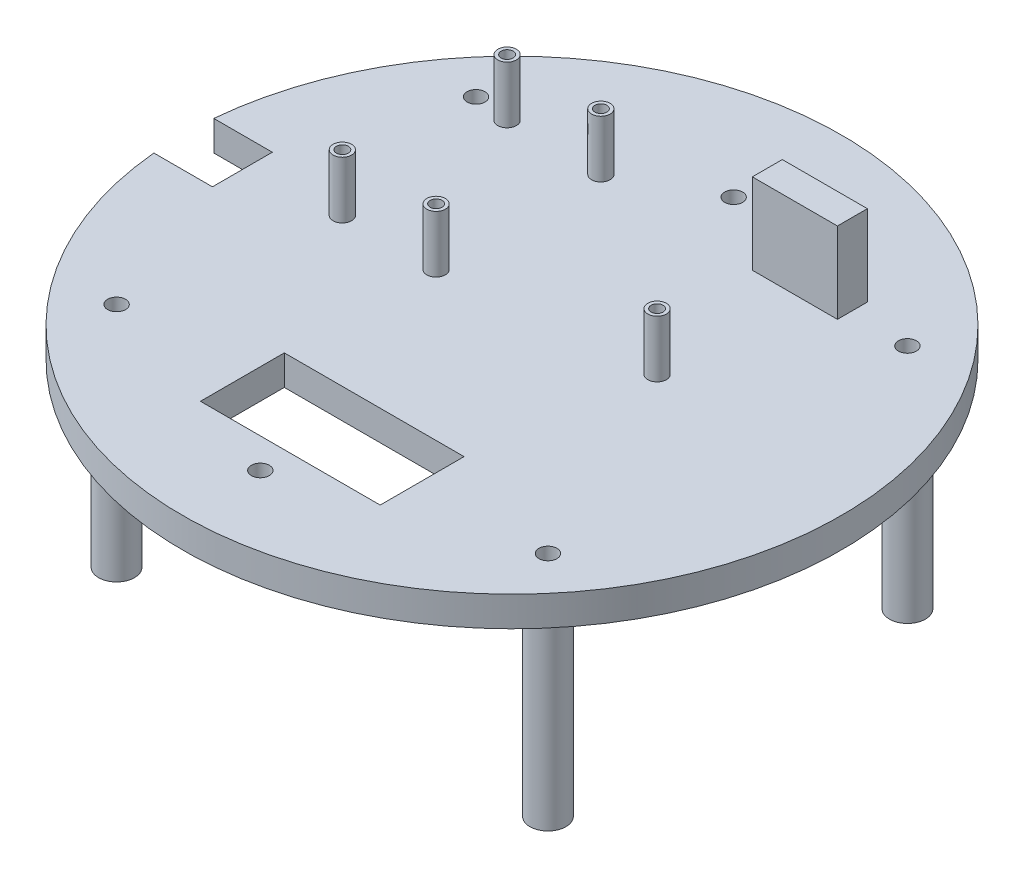
from build123d import *

# Parameters (mm, degrees)
SKETCH2_R                 = 55
SKETCH2_W                 = 30
SKETCH2_H                 = 14
BOSS_EXTRUDE1_DEPTH       = 5
SKETCH3_R                 = 2.5
BOSS_EXTRUDE2_DEPTH       = 6
F_2_5MM_DOWEL_HOLE2_D     = 2.5
F_2_5MM_DOWEL_HOLE2_DEPTH = 10.15
F_2_5MM_DOWEL_HOLE2_TIP   = 0.751075774
SKETCH15_R                = 1.55
BOSS_EXTRUDE3_DEPTH       = 9.5
F_2_0MM_DOWEL_HOLE1_D     = 2
F_2_0MM_DOWEL_HOLE1_DEPTH = 10.15
F_2_0MM_DOWEL_HOLE1_TIP   = 0.600860619
SKETCH17_R                = 1.55
SKETCH17_W                = 14.2
SKETCH17_H                = 5
BOSS_EXTRUDE4_DEPTH       = 9.5
F_2_0MM_DOWEL_HOLE2_D     = 2
F_2_0MM_DOWEL_HOLE2_DEPTH = 10.15
F_2_0MM_DOWEL_HOLE2_TIP   = 0.600860619
SKETCH19_W                = 14.2
SKETCH19_H                = 5
BOSS_EXTRUDE5_DEPTH       = 4
SKETCH21_W                = 10
SKETCH21_H                = 10
CUT_EXTRUDE1_DEPTH        = 79.944600829
SKETCH26_R                = 3
BOSS_EXTRUDE7_DEPTH       = 3
F_3_0MM_DOWEL_HOLE2_D     = 3
SKETCH30_R                = 3
BOSS_EXTRUDE9_DEPTH       = 33
F_3_0MM_DOWEL_HOLE4_D     = 3


with BuildPart() as part:
    # Sketch2 → Boss-Extrude1 (new body)
    with BuildSketch(Plane(origin=(0, 0, 0), x_dir=(1, 0, 0), z_dir=(0, 1, 0))):
        Circle(SKETCH2_R)
        with Locations((0, -30)):
            Rectangle(SKETCH2_W, SKETCH2_H, mode=Mode.SUBTRACT)
    extrude(amount=BOSS_EXTRUDE1_DEPTH)

    # Sketch3 → Boss-Extrude2 (add)
    with BuildSketch(Plane.XZ):
        with Locations((-36.95, 10.6)):
            Circle(SKETCH3_R)
        with Locations((-36.95, -10.6)):
            Circle(SKETCH3_R)
        with Locations((6.95, -10.6)):
            Circle(SKETCH3_R)
        with Locations((6.95, 10.6)):
            Circle(SKETCH3_R)
    extrude(amount=BOSS_EXTRUDE2_DEPTH)

    # Ø2.5mm Dowel Hole2
    with Locations(Plane(origin=(-36.95, -6, 10.6), x_dir=(0, 0, -1), z_dir=(0, -1, 0))):
        with Locations((0, 0), (0, 43.9), (21.2, 43.9), (21.2, 0)):
            Hole(F_2_5MM_DOWEL_HOLE2_D / 2, depth=F_2_5MM_DOWEL_HOLE2_DEPTH)
            with Locations((0, 0, -(F_2_5MM_DOWEL_HOLE2_DEPTH + F_2_5MM_DOWEL_HOLE2_TIP / 2))):  # 118° drill point
                Cone(0, F_2_5MM_DOWEL_HOLE2_D / 2, F_2_5MM_DOWEL_HOLE2_TIP, mode=Mode.SUBTRACT)

    # Sketch15 → Boss-Extrude3 (add)
    with BuildSketch(Plane(origin=(0, 5, 0), x_dir=(1, 0, 0), z_dir=(0, 1, 0))):
        with Locations((-30.02607336, 29.209873591)):
            Circle(SKETCH15_R)
        with Locations((-14.37607336, 29.209873591)):
            Circle(SKETCH15_R)
        with Locations((-14.37607336, 1.709873591)):
            Circle(SKETCH15_R)
        with Locations((-30.02607336, 1.709873591)):
            Circle(SKETCH15_R)
    extrude(amount=BOSS_EXTRUDE3_DEPTH)

    # Ø2.0mm Dowel Hole1
    with Locations(Plane(origin=(-30.02607336, 14.5, -29.209873591), x_dir=(0, 0, 1), z_dir=(0, 1, 0))):
        with Locations((0, 0), (27.5, 0), (27.5, 15.65), (0, 15.65)):
            Hole(F_2_0MM_DOWEL_HOLE1_D / 2, depth=F_2_0MM_DOWEL_HOLE1_DEPTH)
            with Locations((0, 0, -(F_2_0MM_DOWEL_HOLE1_DEPTH + F_2_0MM_DOWEL_HOLE1_TIP / 2))):  # 118° drill point
                Cone(0, F_2_0MM_DOWEL_HOLE1_D / 2, F_2_0MM_DOWEL_HOLE1_TIP, mode=Mode.SUBTRACT)

    # Sketch17 → Boss-Extrude4 (add)
    with BuildSketch(Plane(origin=(0, 5, 0), x_dir=(1, 0, 0), z_dir=(0, 1, 0))):
        with Locations((19.217395201, 5)):
            Circle(SKETCH17_R)
        with Locations((19.217395201, 30.5)):
            Rectangle(SKETCH17_W, SKETCH17_H)
    extrude(amount=BOSS_EXTRUDE4_DEPTH)

    # Ø2.0mm Dowel Hole2
    with Locations(Plane(origin=(19.217395201, 14.5, -5), x_dir=(0, 0, 1), z_dir=(0, 1, 0))):
        with Locations((0, 0)):
            Hole(F_2_0MM_DOWEL_HOLE2_D / 2, depth=F_2_0MM_DOWEL_HOLE2_DEPTH)
            with Locations((0, 0, -(F_2_0MM_DOWEL_HOLE2_DEPTH + F_2_0MM_DOWEL_HOLE2_TIP / 2))):  # 118° drill point
                Cone(0, F_2_0MM_DOWEL_HOLE2_D / 2, F_2_0MM_DOWEL_HOLE2_TIP, mode=Mode.SUBTRACT)

    # Sketch19 → Boss-Extrude5 (add)
    with BuildSketch(Plane(origin=(0, 14.5, 0), x_dir=(1, 0, 0), z_dir=(0, 1, 0))):
        with Locations((19.217395201, 30.5)):
            Rectangle(SKETCH19_W, SKETCH19_H)
    extrude(amount=BOSS_EXTRUDE5_DEPTH)

    # Sketch21 → Cut-Extrude1 (cut, through all)
    with BuildSketch(Plane(origin=(0, 5, 0), x_dir=(1, 0, 0), z_dir=(0, 1, 0))):
        with Locations((-50, 0)):
            Rectangle(SKETCH21_W, SKETCH21_H)
    extrude(amount=-CUT_EXTRUDE1_DEPTH, mode=Mode.SUBTRACT)

    # Sketch26 → Boss-Extrude7 (add)
    with BuildSketch(Plane.XZ):
        with Locations((0, 42)):
            Circle(SKETCH26_R)
        with Locations((0, -37)):
            Circle(SKETCH26_R)
    extrude(amount=BOSS_EXTRUDE7_DEPTH)

    # Ø3.0mm Dowel Hole2 (through all)
    with Locations(Plane(origin=(0, -3, 42), x_dir=(0, 0, -1), z_dir=(0, -1, 0))):
        with Locations((0, 0), (79, 0)):
            Hole(F_3_0MM_DOWEL_HOLE2_D / 2)

    # Sketch30 → Boss-Extrude9 (add)
    with BuildSketch(Plane.XZ):
        with Locations((-36, 30)):
            Circle(SKETCH30_R)
        with Locations((36, 30)):
            Circle(SKETCH30_R)
        with Locations((36, -30)):
            Circle(SKETCH30_R)
        with Locations((-36, -30)):
            Circle(SKETCH30_R)
    extrude(amount=BOSS_EXTRUDE9_DEPTH)

    # Ø3.0mm Dowel Hole4 (through all)
    with Locations(Plane(origin=(-36, -33, 30), x_dir=(0, 0, -1), z_dir=(0, -1, 0))):
        with Locations((0, 0), (0, 72), (60, 72), (60, 0)):
            Hole(F_3_0MM_DOWEL_HOLE4_D / 2)


solid = part.part
